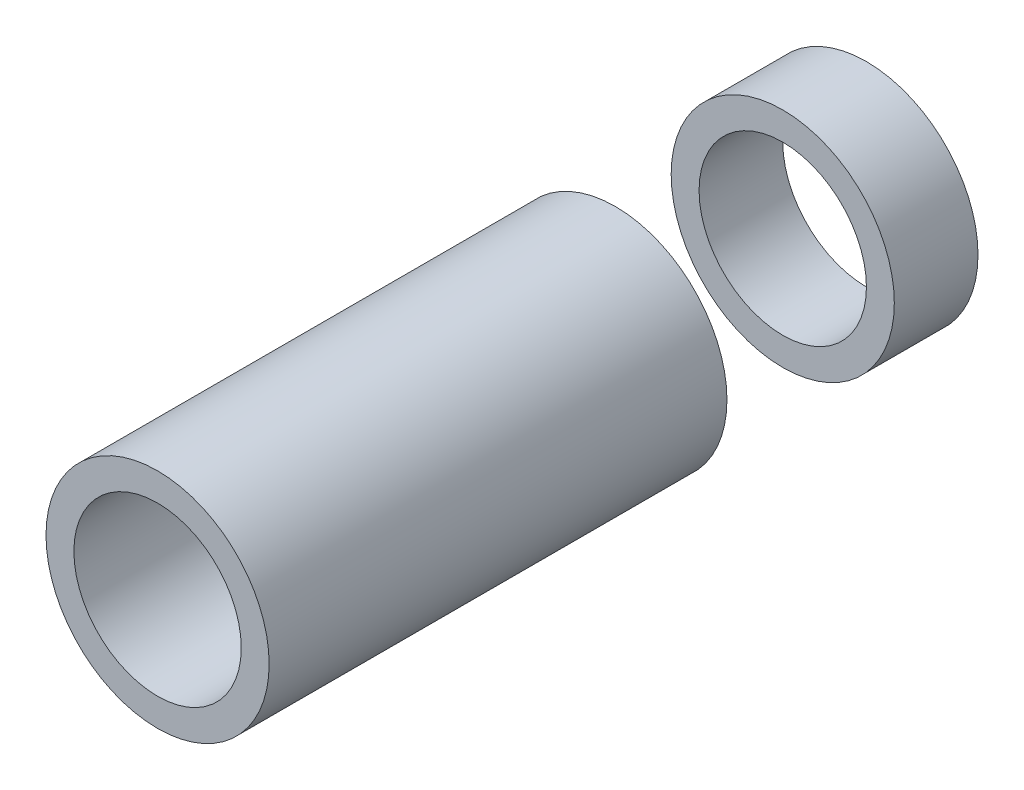
from build123d import *

# Parameters (mm, degrees)
SKETCH2_W   = 32.82608696
SKETCH2_H   = 2
SKETCH2_W_2 = 6


with BuildPart() as part:
    # Sketch2 → Revolve1 (revolve)
    with BuildSketch(Plane(origin=(0, 0, 0), x_dir=(0, 0, -1), z_dir=(1, 0, 0)), mode=Mode.PRIVATE) as revolve1_sk:
        with Locations((16.41304348, 7)):
            Rectangle(SKETCH2_W, SKETCH2_H)
        with Locations((47.82608696, 7)):
            Rectangle(SKETCH2_W_2, SKETCH2_H)
    revolve(revolve1_sk.sketch.rotate(Axis((0, 0, -26.347826087), (0, 0, 1)), 90), axis=Axis((0, 0, -26.347826087), (0, 0, 1)))


solid = part.part
